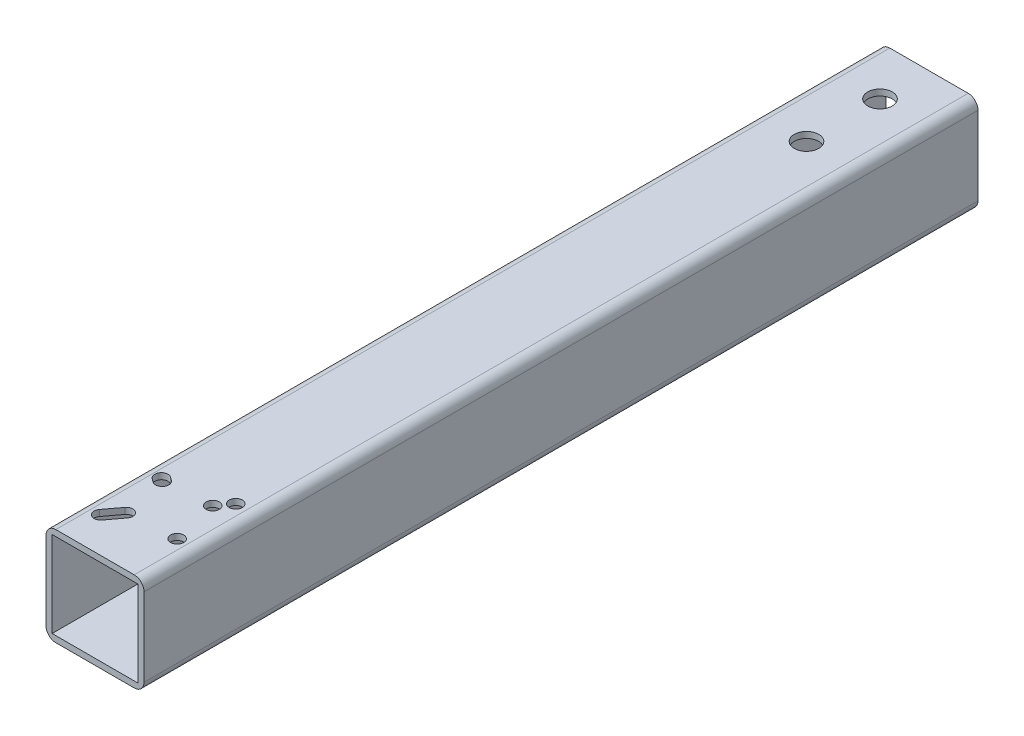
from build123d import *

# Parameters (mm, degrees)
SKETCH1_W           = 25.4
SKETCH1_H           = 25.4
SKETCH1_W_2         = 22.225
SKETCH1_H_2         = 22.225
BOSS_EXTRUDE1_DEPTH = 216.154
FILLET1_R           = 2.54
SKETCH2_R           = 3.175
CUT_EXTRUDE1_DEPTH  = 219.989131036
SKETCH3_R           = 1.7
CUT_EXTRUDE2_DEPTH  = 2.54


with BuildPart() as part:
    # Sketch1 → Boss-Extrude1 (new body)
    with BuildSketch(Plane.XY):
        with Locations((-11.559591837, -1.275183673)):
            Rectangle(SKETCH1_W, SKETCH1_H)
        with Locations((-11.559591837, -1.275183673)):
            Rectangle(SKETCH1_W_2, SKETCH1_H_2, mode=Mode.SUBTRACT)
    extrude(amount=BOSS_EXTRUDE1_DEPTH)

    # Fillet1
    fillet1_edges = [part.edges().sort_by_distance(p)[0] for p in [
        (-24.259591837, 11.424816327, 108.077),
        (1.140408163, 11.424816327, 108.077),
        (1.140408163, -13.975183673, 108.077),
        (-24.259591837, -13.975183673, 108.077),
    ]]
    fillet(fillet1_edges, radius=FILLET1_R)

    # Sketch2 → Cut-Extrude1 (cut, through all)
    with BuildSketch(Plane(origin=(0, 11.424816327, 0), x_dir=(1, 0, 0), z_dir=(0, 1, 0))):
        with Locations(Location((-11.559591837, -12.7, 0), (0, 0, 270))):
            Circle(SKETCH2_R)
        with Locations(Location((-11.559591837, -31.75, 0), (0, 0, 270))):
            Circle(SKETCH2_R)
    extrude(amount=-CUT_EXTRUDE1_DEPTH, mode=Mode.SUBTRACT)

    # Sketch3 → Cut-Extrude2 (cut)
    with BuildSketch(Plane(origin=(0, 11.424816327, 0), x_dir=(1, 0, 0), z_dir=(0, 1, 0))):
        with Locations(Location((-6.745071652, -190.46091592, 0), (0, 0, 270))):
            Circle(SKETCH3_R)
        with Locations(Location((-4.172146269, -187.046528614, 0), (0, 0, 270))):
            Circle(SKETCH3_R)
        with Locations(Location((-3.921994623, -202.499522883, 0), (0, 0, 270))):
            Circle(SKETCH3_R)
        with BuildLine():
            Line((-15.016431655, -204.26216962), (-17.859841481, -208.035501905))
            ThreePointArc((-17.859841481, -208.035501905), (-20.240607387, -208.370096733), (-20.575202215, -205.989330826))
            Line((-20.575202215, -205.989330826), (-17.731792389, -202.215998541))
            ThreePointArc((-17.731792389, -202.215998541), (-15.351026483, -201.881403713), (-15.016431655, -204.26216962))
        make_face()
        with BuildLine():
            Line((-18.594632259, -189.531648392), (-17.777811336, -190.135849998))
            ThreePointArc((-17.777811336, -190.135849998), (-17.422050667, -192.513545173), (-19.799745842, -192.869305842))
            Line((-19.799745842, -192.869305842), (-20.616566765, -192.265104237))
            ThreePointArc((-20.616566765, -192.265104237), (-20.972327435, -189.887409062), (-18.594632259, -189.531648392))
        make_face()
    extrude(amount=-CUT_EXTRUDE2_DEPTH, mode=Mode.SUBTRACT)


solid = part.part
